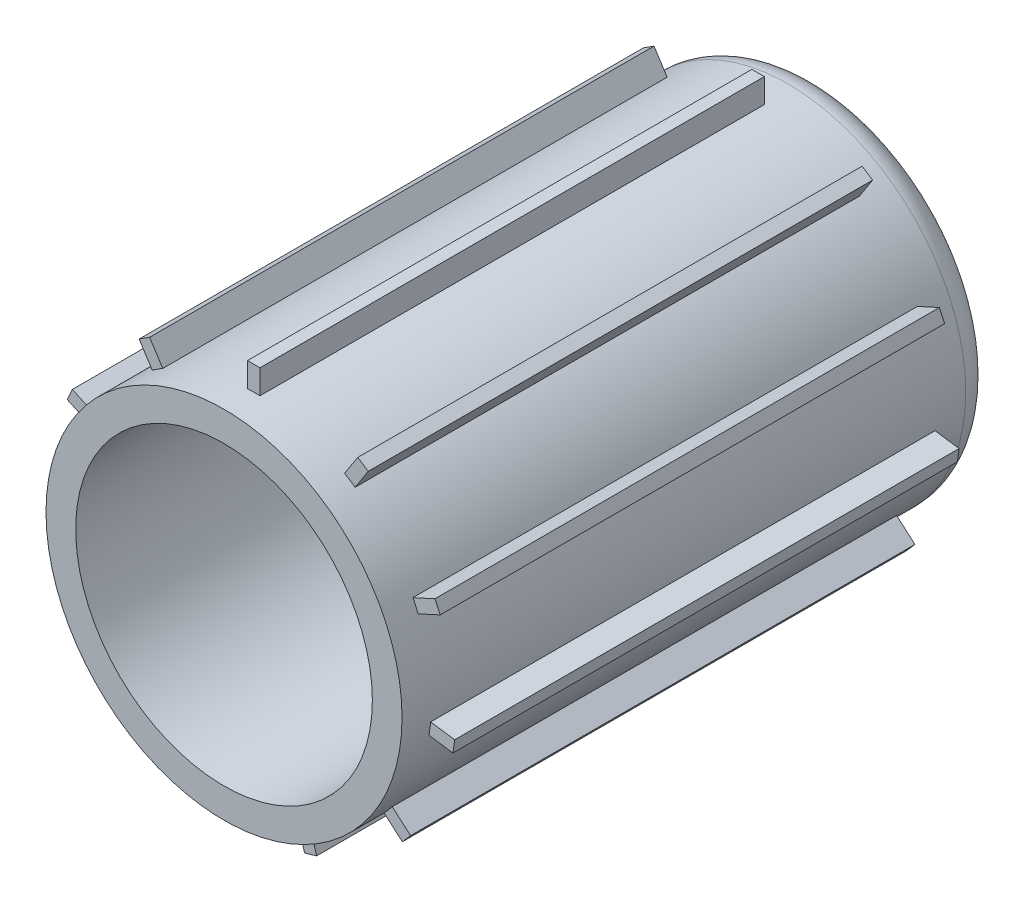
from build123d import *

# Parameters (mm, degrees)
SKETCH1_R           = 60
BOSS_EXTRUDE1_DEPTH = 200
SKETCH2_R           = 50
CUT_EXTRUDE1_DEPTH  = 180
FILLET1_R           = 10
SKETCH3_W           = 4.216139726
SKETCH3_H           = 8.515044219
BOSS_EXTRUDE2_DEPTH = 170
SKETCH4_R           = 20
CUT_EXTRUDE3_DEPTH  = 25


with BuildPart() as part:
    # Sketch1 → Boss-Extrude1 (new body)
    with BuildSketch(Plane.XY):
        Circle(SKETCH1_R)
    extrude(amount=BOSS_EXTRUDE1_DEPTH)

    # Sketch2 → Cut-Extrude1 (cut)
    with BuildSketch(Plane.XY.offset(200)):
        Circle(SKETCH2_R)
    extrude(amount=-CUT_EXTRUDE1_DEPTH, mode=Mode.SUBTRACT)

    # Fillet1
    fillet1_edges = [part.edges().sort_by_distance(p)[0] for p in [
        (-60, 0, 0),
    ]]
    fillet(fillet1_edges, radius=FILLET1_R)

    # Sketch3 → Boss-Extrude2 (add)
    with BuildSketch(Plane.XY.offset(20)):
        with Locations((0, 63.882225371)):
            Rectangle(SKETCH3_W, SKETCH3_H)
        Polygon((34.008969531, 49.019783649), (38.612549999, 56.18309468), (35.065707559, 58.462511908), (30.462127092, 51.299200877), align=None)
        Polygon((55.11226167, 22.851429085), (62.857818333, 26.38870629), (61.106370594, 30.223841881), (53.360813931, 26.686564676), align=None)
        Polygon((58.717800132, -10.572092753), (67.146173479, -11.783909894), (67.746192722, -7.610684391), (59.317819375, -6.39886725), align=None)
        Polygon((43.680851933, -40.639049841), (50.116092977, -46.215217947), (52.877077332, -43.028872144), (46.441836288, -37.452704037), align=None)
        Polygon((14.775541879, -57.803395746), (17.174507059, -65.973520844), (21.219863501, -64.785697019), (18.820898322, -56.615571921), align=None)
        Polygon((-18.820898322, -56.615571921), (-21.219863501, -64.785697019), (-17.174507059, -65.973520844), (-14.775541879, -57.803395746), align=None)
        Polygon((-46.441836288, -37.452704037), (-52.877077332, -43.028872144), (-50.116092977, -46.215217947), (-43.680851933, -40.639049841), align=None)
        Polygon((-59.317819375, -6.39886725), (-67.746192722, -7.610684391), (-67.146173479, -11.783909894), (-58.717800132, -10.572092753), align=None)
        Polygon((-53.360813931, 26.686564676), (-61.106370594, 30.223841881), (-62.857818333, 26.38870629), (-55.11226167, 22.851429085), align=None)
        Polygon((-30.462127092, 51.299200877), (-35.065707559, 58.462511908), (-38.612549999, 56.18309468), (-34.008969531, 49.019783649), align=None)
    extrude(amount=BOSS_EXTRUDE2_DEPTH)

    # Sketch4 → Cut-Extrude3 (cut)
    with BuildSketch(Plane(origin=(0, 0, 0), x_dir=(-1, 0, 0), z_dir=(0, 0, -1))):
        Circle(SKETCH4_R)
    extrude(amount=-CUT_EXTRUDE3_DEPTH, mode=Mode.SUBTRACT)


solid = part.part
